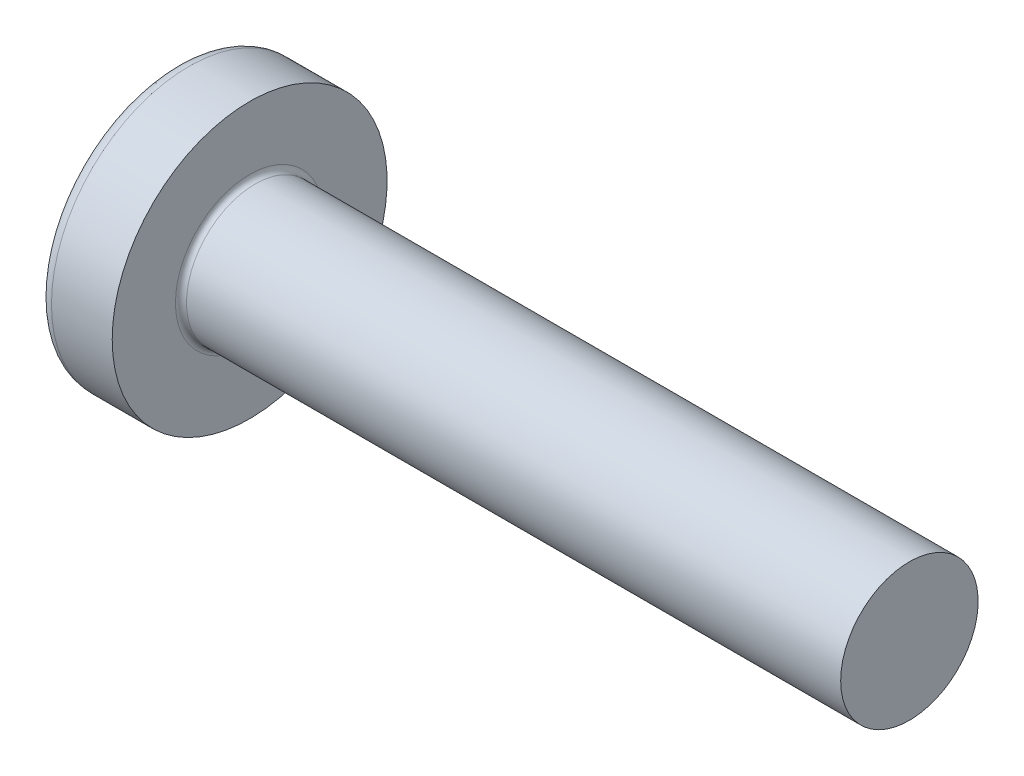
from build123d import *

# Parameters (mm, degrees)
FILLET1_R    = 0.1
RECPAT_COUNT = 2
RECPAT_ANGLE = 90


with BuildPart() as part:
    # BodySke → Base-Revolve (revolve)
    with BuildSketch(Plane.XY, mode=Mode.PRIVATE) as base_revolve_sk:
        with BuildLine():
            Line((2.1, 1.25), (2.1, 2.5))
            Line((2.1, 2.5), (0.99500416, 2.5))
            ThreePointArc((0.99500416, 2.5), (0.88781572, 2.474733878), (0.803195915, 2.404255319))
            ThreePointArc((0.803195915, 2.404255319), (0.206109099, 1.267435138), (0, 0))
            Line((0, 0), (14.1, 0))
            Line((14.1, 0), (14.1, 1.25))
            Line((14.1, 1.25), (2.1, 1.25))
        make_face()
    revolve(base_revolve_sk.sketch.rotate(Axis((0.99500416, 0, 0), (1, 0, 0)), 90), axis=Axis((0.99500416, 0, 0), (1, 0, 0)))

    # Fillet1
    fillet1_edges = [part.edges().sort_by_distance(p)[0] for p in [
        (2.1, 0, -1.25),
    ]]
    fillet(fillet1_edges, radius=FILLET1_R)

    # Sketch3 → Recess section 0
    with BuildSketch(Plane(origin=(0, 0, 0), x_dir=(0, 0, -1), z_dir=(1, 0, 0))):
        with BuildLine():
            Line((0.37, -1.3), (-0.37, -1.3))
            Line((-0.37, -1.3), (-0.37, 1.3))
            Line((-0.37, 1.3), (0.37, 1.3))
            Line((0.37, 1.3), (0.37, -1.3))
        make_face()
    # Sketch4 → Recess section 1
    with BuildSketch(Plane(origin=(1.5, 0, 0), x_dir=(0, 0, -1), z_dir=(1, 0, 0))):
        with BuildLine():
            Line((0.37, -0.552127614), (-0.37, -0.552127614))
            Line((-0.37, -0.552127614), (-0.37, 0.552127614))
            Line((-0.37, 0.552127614), (0.37, 0.552127614))
            Line((0.37, 0.552127614), (0.37, -0.552127614))
        make_face()
    recess = loft(mode=Mode.SUBTRACT)

    # RecPat: Recess ×2 about axis
    recpat_axis = Axis((0, 0, 0), (1, 0, 0))
    for i in range(1, RECPAT_COUNT):
        add(recess.rotate(recpat_axis, i * RECPAT_ANGLE / (RECPAT_COUNT - 1)), mode=Mode.SUBTRACT)

    # RecCorSke → RecessCore (revolve, cut)
    with BuildSketch(Plane.XY, mode=Mode.PRIVATE) as recesscore_sk:
        Polygon((0, 0), (0, 0.660890218), (1.5, 0.556), (1.680655351, 0), align=None)
    revolve(recesscore_sk.sketch.rotate(Axis((-3.175, 0, 0), (1, 0, 0)), 17.145865586), axis=Axis((-3.175, 0, 0), (1, 0, 0)), mode=Mode.SUBTRACT)


solid = part.part
